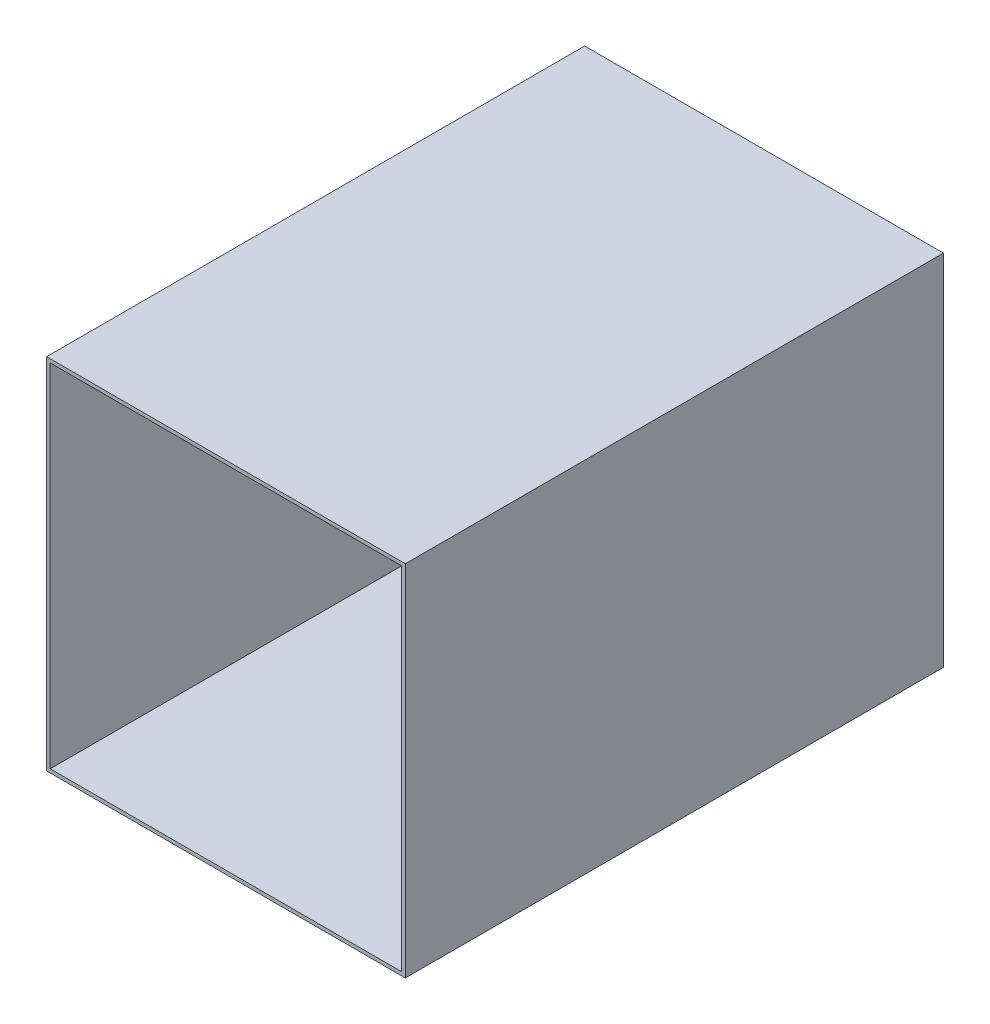
from build123d import *

# Parameters (mm, degrees)
SKETCH_1_W      = 200
SKETCH_1_H      = 200
SKETCH_1_W_2    = 196
SKETCH_1_H_2    = 196
EXTRUDE_1_DEPTH = 150


with BuildPart() as part:
    # 草图1 → 凸台-拉伸1 (new, symmetric)
    with BuildSketch(Plane.XY):
        Rectangle(SKETCH_1_W, SKETCH_1_H)
        Rectangle(SKETCH_1_W_2, SKETCH_1_H_2, mode=Mode.SUBTRACT)
    extrude(amount=EXTRUDE_1_DEPTH, both=True)


solid = part.part
